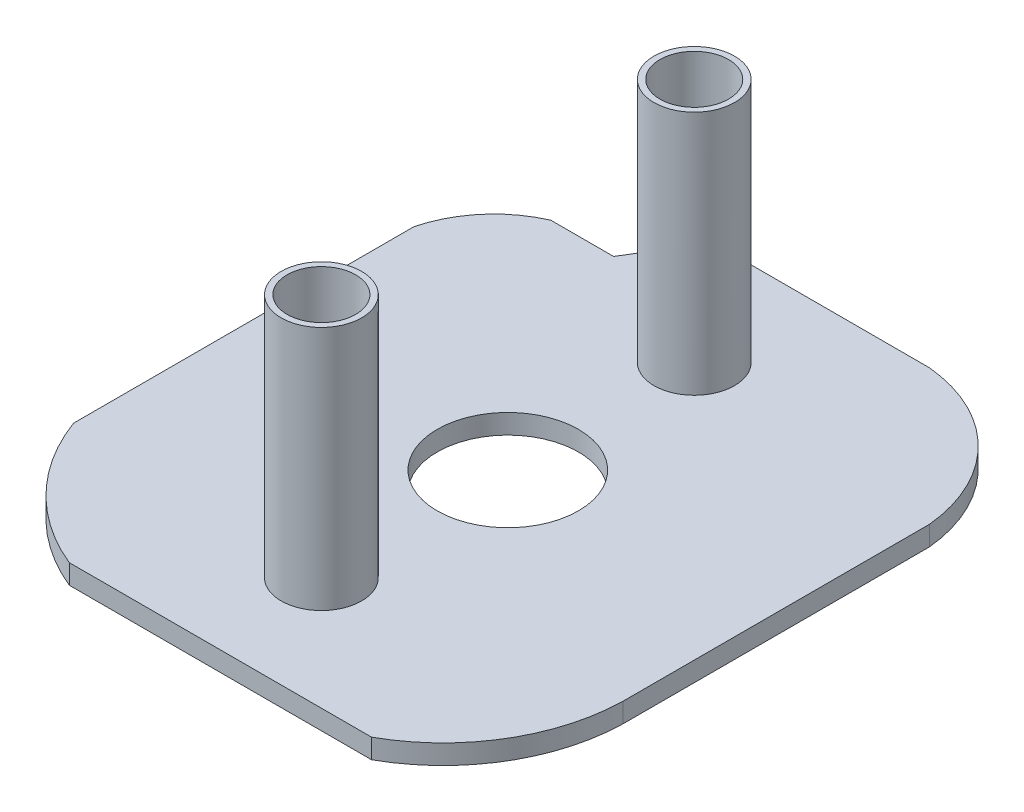
from build123d import *

# Parameters (mm, degrees)
SKETCH3_W               = 262.8
SKETCH3_H               = 305.28
BOSS_EXTRUDE3_DEPTH     = 10
CUT_EXTRUDE1_DEPTH      = 202.655472527
CUT_EXTRUDE1_DEPTH_BACK = 202.655472527
CUT_EXTRUDE2_DEPTH      = 202.655472527
CUT_EXTRUDE2_DEPTH_BACK = 202.655472527
SKETCH5_R               = 36
SKETCH6_R               = 20.52
BOSS_EXTRUDE4_DEPTH     = 125
CUT_EXTRUDE3_DEPTH      = 243.466347356
CUT_EXTRUDE3_DEPTH_BACK = 243.466347356
SKETCH7_R               = 17.5


with BuildPart() as part:
    # Sketch3 → Boss-Extrude3 (new body)
    with BuildSketch(Plane(origin=(0, 0, 0), x_dir=(1, 0, 0), z_dir=(0, 1, 0))):
        Rectangle(SKETCH3_W, SKETCH3_H)
    extrude(amount=BOSS_EXTRUDE3_DEPTH)

    # Sketch4 → Cut-Extrude1 (cut, two sides: drawn at the far end of the back side and taken through both)
    with BuildSketch(Plane(origin=(0, 10, 0), x_dir=(1, 0, 0), z_dir=(0, 1, 0)).offset(-CUT_EXTRUDE1_DEPTH_BACK)):
        with BuildLine():
            Line((-131.4, -90), (-131.4, -152.64))
            Line((-131.4, -152.64), (-70.92, -152.64))
            ThreePointArc((-70.92, -152.64), (-107.755247271, -127.687824951), (-131.4, -90))
        make_face()
        with BuildLine():
            Line((83.16, -152.64), (131.4, -152.64))
            Line((131.4, -152.64), (131.4, -72.72))
            ThreePointArc((131.4, -72.72), (117.938305095, -119.113391364), (83.16, -152.64))
        make_face()
        with BuildLine():
            Line((-99.372734155, 121.287125755), (-67.345468311, 121.287125755))
            Line((-67.345468311, 121.287125755), (-48.15934209, 152.64))
            Line((-48.15934209, 152.64), (-131.4, 152.64))
            Line((-131.4, 152.64), (-131.4, 83.52))
            ThreePointArc((-131.4, 83.52), (-119.737831056, 106.093689962), (-99.372734155, 121.287125755))
        make_face()
        with BuildLine():
            Line((131.4, 83.52), (131.4, 152.64))
            Line((131.4, 152.64), (62.28, 152.64))
            ThreePointArc((62.28, 152.64), (109.286007047, 130.526007047), (131.4, 83.52))
        make_face()
    extrude(amount=CUT_EXTRUDE1_DEPTH + CUT_EXTRUDE1_DEPTH_BACK, mode=Mode.SUBTRACT)

    # Sketch5 → Cut-Extrude2 (cut, two sides: drawn at the far end of the back side and taken through both)
    with BuildSketch(Plane(origin=(0, 10, 0), x_dir=(1, 0, 0), z_dir=(0, 1, 0)).offset(-CUT_EXTRUDE2_DEPTH_BACK)):
        with Locations(Location((0, 0, 0), (0, 0, 270))):
            Circle(SKETCH5_R)
    extrude(amount=CUT_EXTRUDE2_DEPTH + CUT_EXTRUDE2_DEPTH_BACK, mode=Mode.SUBTRACT)

    # Sketch6 → Boss-Extrude4 (add)
    with BuildSketch(Plane(origin=(0, 10, 0), x_dir=(1, 0, 0), z_dir=(0, 1, 0))):
        with Locations(Location((0, 95.04, 0), (0, 0, 90))):
            Circle(SKETCH6_R)
        with Locations(Location((0, -95.04, 0), (0, 0, 90))):
            Circle(SKETCH6_R)
    extrude(amount=BOSS_EXTRUDE4_DEPTH)

    # Sketch7 → Cut-Extrude3 (cut, two sides: drawn at the far end of the back side and taken through both)
    with BuildSketch(Plane(origin=(0, 135, 0), x_dir=(1, 0, 0), z_dir=(0, 1, 0)).offset(-CUT_EXTRUDE3_DEPTH_BACK)):
        with Locations(Location((0, 95.04, 0), (0, 0, 270))):
            Circle(SKETCH7_R)
        with Locations(Location((0, -95.04, 0), (0, 0, 90))):
            Circle(SKETCH7_R)
    extrude(amount=CUT_EXTRUDE3_DEPTH + CUT_EXTRUDE3_DEPTH_BACK, mode=Mode.SUBTRACT)


solid = part.part
